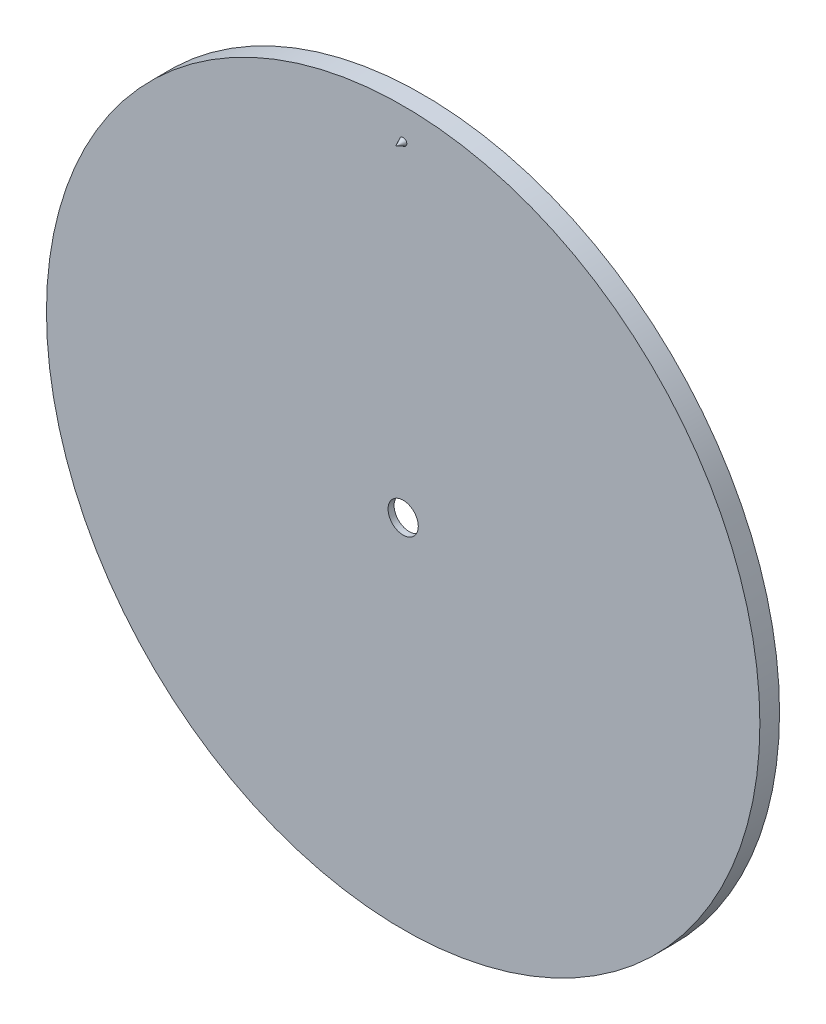
from build123d import *

# Parameters (mm, degrees)
SKETCH1_R           = 74.93
SKETCH1_R_2         = 3.175
BOSS_EXTRUDE1_DEPTH = 4.1275
SKETCH2_R           = 73.66
CUT_EXTRUDE1_DEPTH  = 2.8575


with BuildPart() as part:
    # Sketch1 → Boss-Extrude1 (new body)
    with BuildSketch(Plane.XY):
        Circle(SKETCH1_R)
        Circle(SKETCH1_R_2, mode=Mode.SUBTRACT)
    extrude(amount=BOSS_EXTRUDE1_DEPTH)

    # Sketch2 → Cut-Extrude1 (cut)
    with BuildSketch(Plane(origin=(0, 0, 0), x_dir=(-1, 0, 0), z_dir=(0, 0, -1))):
        Circle(SKETCH2_R)
    extrude(amount=-CUT_EXTRUDE1_DEPTH, mode=Mode.SUBTRACT)

    # Sketch3 → Revolve1 (revolve)
    with BuildSketch(Plane(origin=(0, 0, 0), x_dir=(0, 0, -1), z_dir=(1, 0, 0)), mode=Mode.PRIVATE) as revolve1_sk:
        Polygon((-5.6515, 68.400374819), (-4.1275, 69.162374819), (-4.1275, 68.400374819), align=None)
    revolve(revolve1_sk.sketch.rotate(Axis((0, 68.400374819, 5.6515), (0, 0, -1)), 270), axis=Axis((0, 68.400374819, 5.6515), (0, 0, -1)))


solid = part.part
